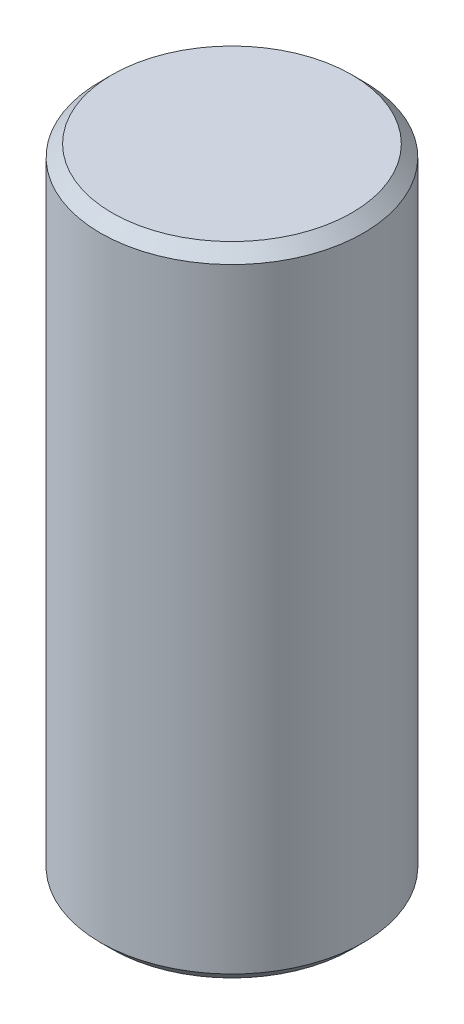
from build123d import *

# Parameters (mm, degrees)
ESBO_O1_R                = 16.9
RESSALTO_EXTRUS_O1_DEPTH = 82
CHANFRO1_SIZE            = 1.5


with BuildPart() as part:
    # Esboço1 → Ressalto-extrusão1 (new body)
    with BuildSketch(Plane(origin=(0, 0, 0), x_dir=(1, 0, 0), z_dir=(0, 1, 0))):
        with Locations(Location((0, 0, 0), (0, 0, 270))):
            Circle(ESBO_O1_R)
    extrude(amount=RESSALTO_EXTRUS_O1_DEPTH)

    # Chanfro1
    chanfro1_edges = [part.edges().sort_by_distance(p)[0] for p in [
        (0, 0, -16.9),
        (0, 82, -16.9),
    ]]
    chamfer(chanfro1_edges, length=CHANFRO1_SIZE)


solid = part.part
